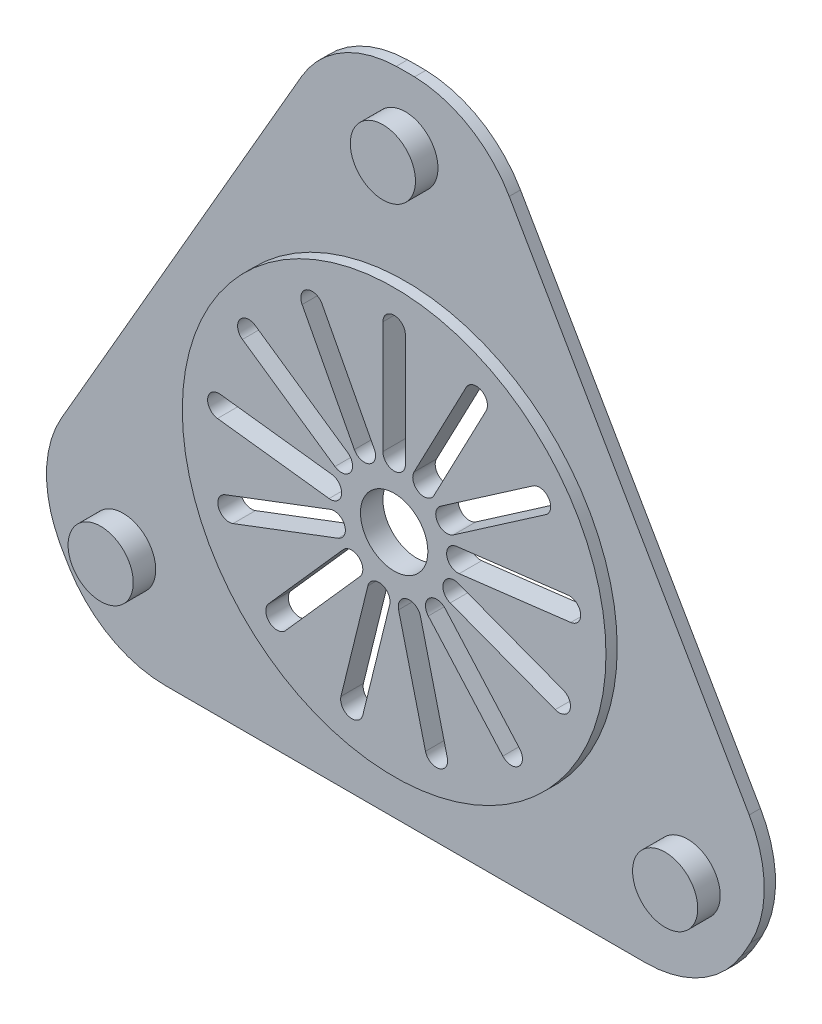
from build123d import *

# Parameters (mm, degrees)
SKETCH2_R           = 18.85
SKETCH2_R_2         = 3
BOSS_EXTRUDE1_DEPTH = 2
BOSS_EXTRUDE2_START = -1
SKETCH3_R           = 35
SKETCH3_R_2         = 18.85
BOSS_EXTRUDE2_DEPTH = 1
SKETCH4_R           = 2.9
BOSS_EXTRUDE3_DEPTH = 3
SKETCH6_R           = 5
BOSS_EXTRUDE4_DEPTH = 1
SKETCH7_R           = 59.131365533
CUT_EXTRUDE1_DEPTH  = 10
FILLET1_R           = 10


with BuildPart() as part:
    # Sketch2 → Boss-Extrude1 (new body)
    with BuildSketch(Plane.XY.offset(10)):
        Circle(SKETCH2_R)
        Circle(SKETCH2_R_2, mode=Mode.SUBTRACT)
        with BuildLine():
            Line((1, 15.711728477), (1, 5.711728477))
            ThreePointArc((1, 5.711728477), (0, 4.711728477), (-1, 5.711728477))
            Line((-1, 5.711728477), (-1, 15.711728477))
            ThreePointArc((-1, 15.711728477), (0, 16.711728477), (1, 15.711728477))
        make_face(mode=Mode.SUBTRACT)
        with BuildLine():
            Line((6.416148271, 14.376767826), (1.76891655, 5.522207569))
            ThreePointArc((1.76891655, 5.522207569), (2.189649404, 4.172028372), (3.539828602, 4.592761225))
            Line((3.539828602, 4.592761225), (8.187060322, 13.447321482))
            ThreePointArc((8.187060322, 13.447321482), (7.766327468, 14.797500679), (6.416148271, 14.376767826))
        make_face(mode=Mode.SUBTRACT)
        with BuildLine():
            Line((12.362434295, 9.748262924), (4.132595637, 4.067615457))
            ThreePointArc((4.132595637, 4.067615457), (3.877676517, 2.676566844), (5.26872513, 2.421647725))
            Line((5.26872513, 2.421647725), (13.498563789, 8.102295192))
            ThreePointArc((13.498563789, 8.102295192), (13.753482908, 9.493343805), (12.362434295, 9.748262924))
        make_face(mode=Mode.SUBTRACT)
        with BuildLine():
            Line((15.476635607, 2.886548466), (5.549546866, 1.681181663))
            ThreePointArc((5.549546866, 1.681181663), (4.677374672, 0.567936109), (5.790620226, -0.304236085))
            Line((5.790620226, -0.304236085), (15.717708967, 0.901130718))
            ThreePointArc((15.717708967, 0.901130718), (16.589881161, 2.014376272), (15.476635607, 2.886548466))
        make_face(mode=Mode.SUBTRACT)
        with BuildLine():
            Line((15.045326214, -4.636439459), (5.695163787, -1.090390589))
            ThreePointArc((5.695163787, -1.090390589), (4.405542658, -1.670801945), (4.985954013, -2.960423074))
            Line((4.985954013, -2.960423074), (14.33611644, -6.506471945))
            ThreePointArc((14.33611644, -6.506471945), (15.62573757, -5.926060589), (15.045326214, -4.636439459))
        make_face(mode=Mode.SUBTRACT)
        with BuildLine():
            Line((11.167313902, -11.097274979), (4.536087319, -3.612167498))
            ThreePointArc((4.536087319, -3.612167498), (3.124453913, -3.526779408), (3.039065823, -4.938412814))
            Line((3.039065823, -4.938412814), (9.670292405, -12.423520296))
            ThreePointArc((9.670292405, -12.423520296), (11.081925812, -12.508908386), (11.167313902, -11.097274979))
        make_face(mode=Mode.SUBTRACT)
        with BuildLine():
            Line((4.731004555, -15.015858538), (2.337847912, -5.306440364))
            ThreePointArc((2.337847912, -5.306440364), (1.127590431, -4.574814211), (0.395964277, -5.785071693))
            Line((0.395964277, -5.785071693), (2.78912092, -15.494489867))
            ThreePointArc((2.78912092, -15.494489867), (3.999378402, -16.22611602), (4.731004555, -15.015858538))
        make_face(mode=Mode.SUBTRACT)
        with BuildLine():
            Line((-2.78912092, -15.494489867), (-0.395964277, -5.785071693))
            ThreePointArc((-0.395964277, -5.785071693), (-1.127590431, -4.574814211), (-2.337847912, -5.306440364))
            Line((-2.337847912, -5.306440364), (-4.731004555, -15.015858538))
            ThreePointArc((-4.731004555, -15.015858538), (-3.999378402, -16.22611602), (-2.78912092, -15.494489867))
        make_face(mode=Mode.SUBTRACT)
        with BuildLine():
            Line((-9.670292405, -12.423520296), (-3.039065823, -4.938412814))
            ThreePointArc((-3.039065823, -4.938412814), (-3.124453913, -3.526779408), (-4.536087319, -3.612167498))
            Line((-4.536087319, -3.612167498), (-11.167313902, -11.097274979))
            ThreePointArc((-11.167313902, -11.097274979), (-11.081925812, -12.508908386), (-9.670292405, -12.423520296))
        make_face(mode=Mode.SUBTRACT)
        with BuildLine():
            Line((-14.33611644, -6.506471945), (-4.985954013, -2.960423074))
            ThreePointArc((-4.985954013, -2.960423074), (-4.405542658, -1.670801945), (-5.695163787, -1.090390589))
            Line((-5.695163787, -1.090390589), (-15.045326214, -4.636439459))
            ThreePointArc((-15.045326214, -4.636439459), (-15.62573757, -5.926060589), (-14.33611644, -6.506471945))
        make_face(mode=Mode.SUBTRACT)
        with BuildLine():
            Line((-15.717708967, 0.901130718), (-5.790620226, -0.304236085))
            ThreePointArc((-5.790620226, -0.304236085), (-4.677374672, 0.567936109), (-5.549546866, 1.681181663))
            Line((-5.549546866, 1.681181663), (-15.476635607, 2.886548466))
            ThreePointArc((-15.476635607, 2.886548466), (-16.589881161, 2.014376272), (-15.717708967, 0.901130718))
        make_face(mode=Mode.SUBTRACT)
        with BuildLine():
            Line((-13.498563789, 8.102295192), (-5.26872513, 2.421647725))
            ThreePointArc((-5.26872513, 2.421647725), (-3.877676517, 2.676566844), (-4.132595637, 4.067615457))
            Line((-4.132595637, 4.067615457), (-12.362434295, 9.748262924))
            ThreePointArc((-12.362434295, 9.748262924), (-13.753482908, 9.493343805), (-13.498563789, 8.102295192))
        make_face(mode=Mode.SUBTRACT)
        with BuildLine():
            Line((-8.187060322, 13.447321482), (-3.539828602, 4.592761225))
            ThreePointArc((-3.539828602, 4.592761225), (-2.189649404, 4.172028372), (-1.76891655, 5.522207569))
            Line((-1.76891655, 5.522207569), (-6.416148271, 14.376767826))
            ThreePointArc((-6.416148271, 14.376767826), (-7.766327468, 14.797500679), (-8.187060322, 13.447321482))
        make_face(mode=Mode.SUBTRACT)
    extrude(amount=-BOSS_EXTRUDE1_DEPTH)

    # Sketch3 → Boss-Extrude2 (add)
    with BuildSketch(Plane(origin=(0, 0, 8), x_dir=(-1, 0, 0), z_dir=(0, 0, -1)).offset(BOSS_EXTRUDE2_START)):
        Circle(SKETCH3_R)
        with Locations(Location((0, 0, 0), (0, 0, 180))):
            Circle(SKETCH3_R_2, mode=Mode.SUBTRACT)
    extrude(amount=BOSS_EXTRUDE2_DEPTH)

    # Sketch4 → Boss-Extrude3 (add)
    with BuildSketch(Plane(origin=(0, 0, 8), x_dir=(-1, 0, 0), z_dir=(0, 0, -1))):
        with Locations((0, 29)):
            Circle(SKETCH4_R)
        with Locations((25.11473671, -14.5)):
            Circle(SKETCH4_R)
        with Locations((-25.11473671, -14.5)):
            Circle(SKETCH4_R)
    extrude(amount=-BOSS_EXTRUDE3_DEPTH)

    # Sketch6 → Boss-Extrude4 (add)
    with BuildSketch(Plane(origin=(0, 0, 9), x_dir=(-1, 0, 0), z_dir=(0, 0, -1))):
        with Locations((0, 30)):
            Circle(SKETCH6_R)
        with Locations((25.980762114, -15)):
            Circle(SKETCH6_R)
        with Locations((-25.980762114, -15)):
            Circle(SKETCH6_R)
    extrude(amount=BOSS_EXTRUDE4_DEPTH)

    # Sketch7 → Cut-Extrude1 (cut)
    with BuildSketch(Plane(origin=(0, 0, 8), x_dir=(-1, 0, 0), z_dir=(0, 0, -1))):
        Circle(SKETCH7_R)
        Polygon((0, 46), (-39.837168574, -23), (39.837168574, -23), align=None, mode=Mode.SUBTRACT)
    extrude(amount=-CUT_EXTRUDE1_DEPTH, mode=Mode.SUBTRACT)

    # Fillet1
    fillet1_edges = [part.edges().sort_by_distance(p)[0] for p in [
        (-6.727678329, 34.347319318, 8.5),
        (-33.109490245, -11.347319318, 8.5),
        (-26.381811917, -23, 8.5),
        (26.381811917, -23, 8.5),
        (33.109490245, -11.347319318, 8.5),
        (6.727678329, 34.347319318, 8.5),
    ]]
    fillet(fillet1_edges, radius=FILLET1_R)


solid = part.part
